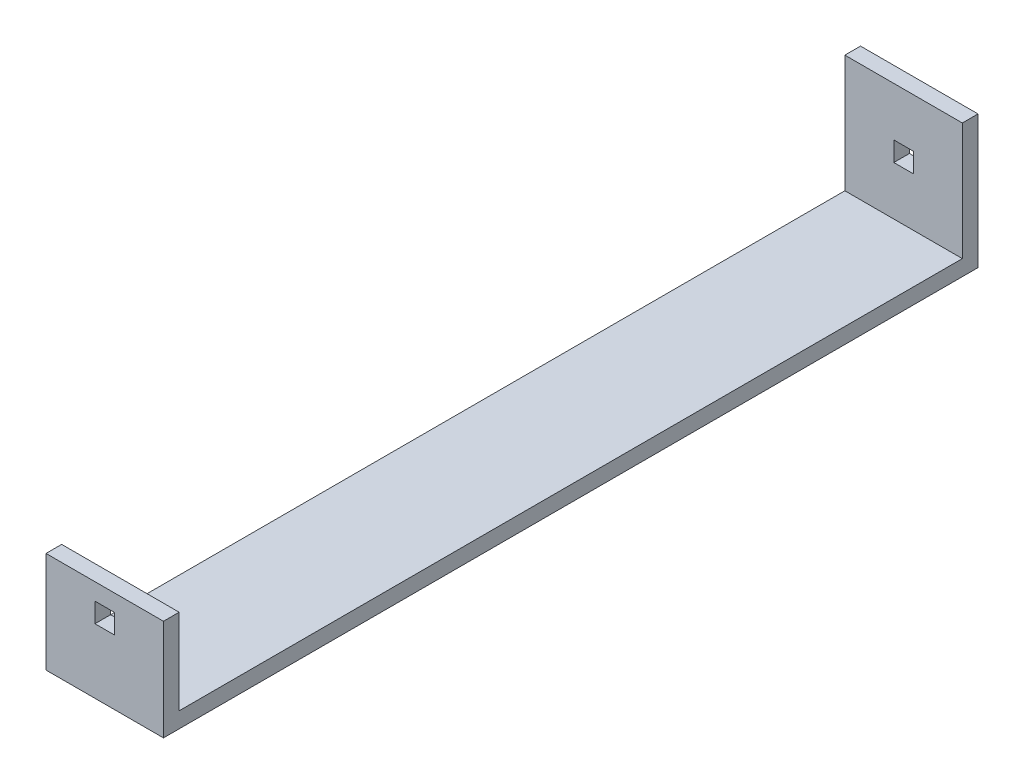
from build123d import *

# Parameters (mm, degrees)
SKETCH2_W               = 150
SKETCH2_H               = 1040
BOSS_EXTRUDE1_DEPTH     = 20
SKETCH3_W               = 150
SKETCH3_H               = 20
BOSS_EXTRUDE2_DEPTH     = 150
CUT_EXTRUDE1_DEPTH      = 1054.434857977
CUT_EXTRUDE1_DEPTH_BACK = 1054.434857977
SKETCH4_W               = 25
SKETCH4_H               = 25
SKETCH5_R               = 6
BOSS_EXTRUDE3_DEPTH     = 10
CUT_EXTRUDE2_REACH      = 1055.435
SKETCH6_W               = 150
SKETCH6_H               = 41


with BuildPart() as part:
    # Sketch2 → Boss-Extrude1 (new body)
    with BuildSketch(Plane(origin=(0, 0, 0), x_dir=(1, 0, 0), z_dir=(0, 1, 0))):
        Rectangle(SKETCH2_W, SKETCH2_H)
    extrude(amount=-BOSS_EXTRUDE1_DEPTH)

    # Sketch3 → Boss-Extrude2 (add)
    with BuildSketch(Plane(origin=(0, 0, 0), x_dir=(1, 0, 0), z_dir=(0, 1, 0))):
        with Locations((0, -510)):
            Rectangle(SKETCH3_W, SKETCH3_H)
        with Locations((0, 510)):
            Rectangle(SKETCH3_W, SKETCH3_H)
    extrude(amount=BOSS_EXTRUDE2_DEPTH)

    # Sketch4 → Cut-Extrude1 (cut, two sides: drawn at the far end of the back side and taken through both)
    with BuildSketch(Plane.XY.offset(520).offset(-CUT_EXTRUDE1_DEPTH_BACK)):
        with Locations((0, 75)):
            Rectangle(SKETCH4_W, SKETCH4_H)
    extrude(amount=CUT_EXTRUDE1_DEPTH + CUT_EXTRUDE1_DEPTH_BACK, mode=Mode.SUBTRACT)

    # Sketch5 → Boss-Extrude3 (add)
    with BuildSketch(Plane.XZ.offset(20)):
        with Locations(Location((-55, 500, 0), (0, 0, 270))):
            Circle(SKETCH5_R)
        with Locations(Location((55, 500, 0), (0, 0, 270))):
            Circle(SKETCH5_R)
        with Locations(Location((-55, -500, 0), (0, 0, 270))):
            Circle(SKETCH5_R)
        with Locations(Location((55, -500, 0), (0, 0, 270))):
            Circle(SKETCH5_R)
    extrude(amount=BOSS_EXTRUDE3_DEPTH)

    # Sketch6 → Cut-Extrude2 (cut, up to next)
    with BuildSketch(Plane.XY.offset(520), mode=Mode.PRIVATE) as cut_extrude2_sk1:
        with Locations((0, 129.5)):
            Rectangle(SKETCH6_W, SKETCH6_H)
    cut_extrude2_tool1 = extrude(cut_extrude2_sk1.sketch, amount=-CUT_EXTRUDE2_REACH, mode=Mode.PRIVATE) & part.part
    add(cut_extrude2_tool1.solids().sort_by_distance((0, 129.5, 520))[0], mode=Mode.SUBTRACT)


solid = part.part
